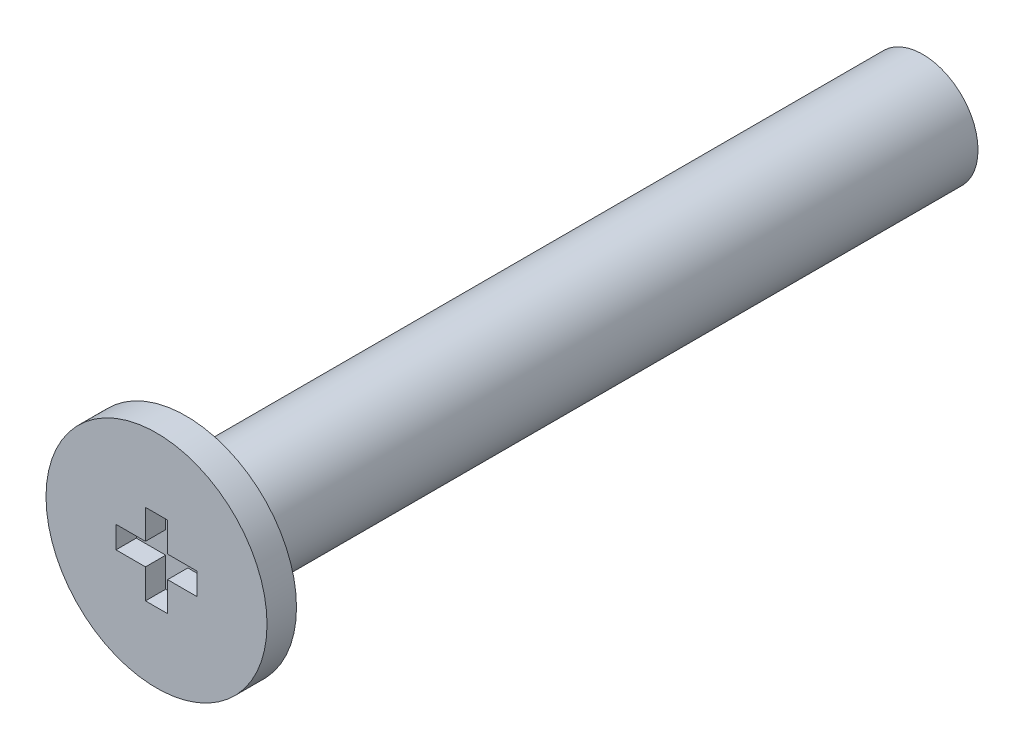
from build123d import *

# Parameters (mm, degrees)
SKETCH_1_R        = 1.5
EXTRUDE_198_DEPTH = 20
SKETCH_6_W        = 3
SKETCH_6_H        = 0.8
PH1_START         = 0.81
PH1_DEPTH         = 0.56


with BuildPart() as part:
    # 草图1 → Extrude 198 (new body)
    with BuildSketch(Plane.XY):
        Circle(SKETCH_1_R)
    extrude(amount=-EXTRUDE_198_DEPTH)

    # 草图6 → Revolve 324 (revolve)
    with BuildSketch(Plane(origin=(0, 0, 0), x_dir=(1, 0, 0), z_dir=(0, 1, 0)), mode=Mode.PRIVATE) as revolve_324_sk:
        with Locations((1.5, -0.4)):
            Rectangle(SKETCH_6_W, SKETCH_6_H)
    revolve(revolve_324_sk.sketch.rotate(Axis((0, 0, -2), (0, 0, 1)), 180), axis=Axis((0, 0, -2), (0, 0, 1)))

    # 草图7 → 十字槽_PH1_简化 (cut)
    with BuildSketch(Plane.XY.offset(PH1_START)):
        Polygon((-0.3, -1.1), (0.3, -1.1), (0.3, -0.3), (1.1, -0.3), (1.1, 0.3), (0.3, 0.3), (0.3, 1.1), (-0.3, 1.1), (-0.3, 0.3), (-1.1, 0.3), (-1.1, -0.3), (-0.3, -0.3), align=None)
    extrude(amount=-PH1_DEPTH, mode=Mode.SUBTRACT)


solid = part.part
